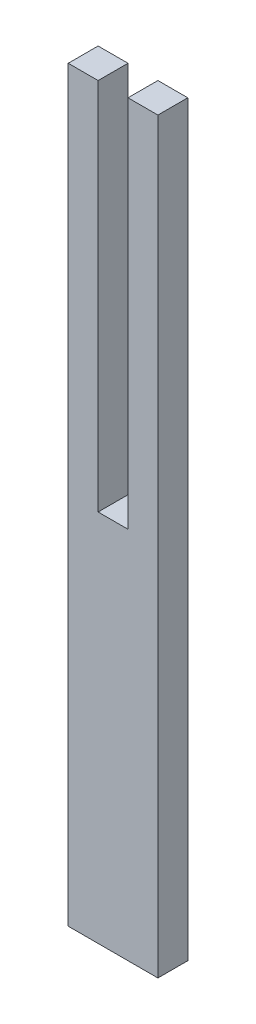
from build123d import *

# Parameters (mm, degrees)
BOSS_EXTRUDE1_DEPTH = 5.08


with BuildPart() as part:
    # Sketch1 → Boss-Extrude1 (new body)
    with BuildSketch(Plane.XY):
        Polygon((-28.284659021, 42.896065644), (-28.284659021, -84.103934356), (-13.044659021, -84.103934356), (-13.044659021, 42.896065644), (-18.124659021, 42.896065644), (-18.124659021, -20.603934356), (-23.204659021, -20.603934356), (-23.204659021, 42.896065644), align=None)
    extrude(amount=BOSS_EXTRUDE1_DEPTH)


solid = part.part
